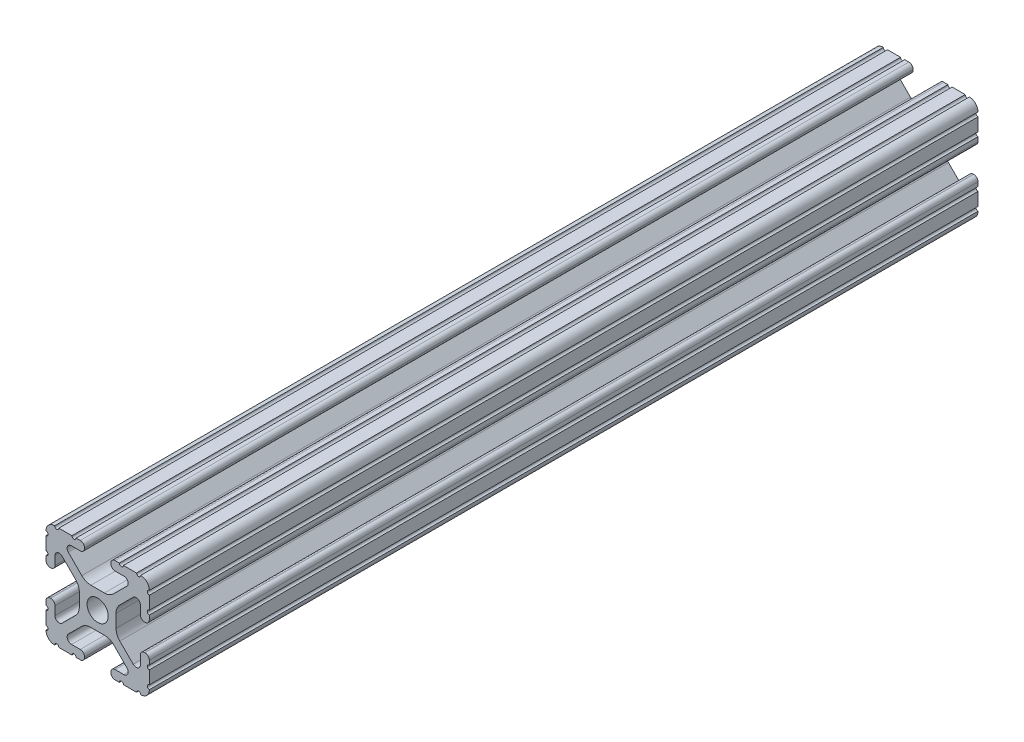
from build123d import *

# Parameters (mm, degrees)
EXTRUDE1_DEPTH      = 0.508
EXTRUDE1_DEPTH_BACK = 203.2
SKETCH1_R           = 2.6035


with BuildPart() as part:
    # Sketch1 → Extrude1 (new, two sides: drawn at the far end of the back side and taken through both)
    with BuildSketch(Plane.XY.offset(-EXTRUDE1_DEPTH_BACK)):
        with BuildLine():
            Line((-7.207036008, 8.724370562), (-3.898272566, 5.423169045))
            ThreePointArc((-3.898272566, 5.423169045), (-2.869120213, 4.736787962), (-1.655778399, 4.4958))
            Line((-1.655778399, 4.4958), (1.655778399, 4.4958))
            ThreePointArc((1.655778399, 4.4958), (2.869120213, 4.736787962), (3.898272566, 5.423169045))
            Line((3.898272566, 5.423169045), (7.207036008, 8.724370562))
            ThreePointArc((7.207036008, 8.724370562), (7.432222385, 9.85140422), (6.476788598, 10.4902))
            Line((6.476788598, 10.4902), (4.287512407, 10.4902))
            ThreePointArc((4.287512407, 10.4902), (3.54574862, 10.79744862), (3.2385, 11.539212407))
            Line((3.2385, 11.539212407), (3.2385, 11.650987593))
            ThreePointArc((3.2385, 11.650987593), (3.54574862, 12.39275138), (4.287512407, 12.7))
            Line((4.287512407, 12.7), (5.317126718, 12.7))
            ThreePointArc((5.317126718, 12.7), (5.825126718, 12.192), (6.333126718, 12.7))
            Line((6.333126718, 12.7), (9.550443118, 12.7))
            ThreePointArc((9.550443118, 12.7), (10.058366869, 12.192000006), (10.566443095, 12.699847501))
            ThreePointArc((10.566443095, 12.699847501), (12.082537762, 12.08250727), (12.699846982, 10.566399977))
            ThreePointArc((12.699846982, 10.566399977), (12.192000006, 10.058323491), (12.7, 9.5504))
            Line((12.7, 9.5504), (12.7, 6.3330836))
            ThreePointArc((12.7, 6.3330836), (12.192, 5.8250836), (12.7, 5.3170836))
            Line((12.7, 5.3170836), (12.7, 4.287469289))
            ThreePointArc((12.7, 4.287469289), (12.39275138, 3.545705502), (11.650987593, 3.238456882))
            Line((11.650987593, 3.238456882), (11.539212407, 3.238456882))
            ThreePointArc((11.539212407, 3.238456882), (10.79744862, 3.545705502), (10.4902, 4.287469289))
            Line((10.4902, 4.287469289), (10.4902, 6.402089023))
            ThreePointArc((10.4902, 6.402089023), (9.856505071, 7.351067942), (8.737131347, 7.129408934))
            Line((8.737131347, 7.129408934), (5.441005833, 3.840816462))
            ThreePointArc((5.441005833, 3.840816462), (4.750877967, 2.809883091), (4.5085, 1.593185507))
            Line((4.5085, 1.593185507), (4.5085, -1.593185507))
            ThreePointArc((4.5085, -1.593185507), (4.750877967, -2.809883091), (5.441005833, -3.840816462))
            Line((5.441005833, -3.840816462), (8.737131347, -7.129408934))
            ThreePointArc((8.737131347, -7.129408934), (9.856505071, -7.351067942), (10.4902, -6.402089023))
            Line((10.4902, -6.402089023), (10.4902, -4.287469289))
            ThreePointArc((10.4902, -4.287469289), (10.79744862, -3.545705502), (11.539212407, -3.238456882))
            Line((11.539212407, -3.238456882), (11.650987593, -3.238456882))
            ThreePointArc((11.650987593, -3.238456882), (12.39275138, -3.545705502), (12.7, -4.287469289))
            Line((12.7, -4.287469289), (12.7, -5.3170836))
            ThreePointArc((12.7, -5.3170836), (12.192, -5.8250836), (12.7, -6.3330836))
            Line((12.7, -6.3330836), (12.7, -9.5504))
            ThreePointArc((12.7, -9.5504), (12.192000006, -10.058323491), (12.699846982, -10.566399977))
            ThreePointArc((12.699846982, -10.566399977), (12.082537762, -12.08250727), (10.566443095, -12.699847501))
            ThreePointArc((10.566443095, -12.699847501), (10.058366869, -12.192000006), (9.550443118, -12.7))
            Line((9.550443118, -12.7), (6.333126718, -12.7))
            ThreePointArc((6.333126718, -12.7), (5.825126718, -12.192), (5.317126718, -12.7))
            Line((5.317126718, -12.7), (4.287512407, -12.7))
            ThreePointArc((4.287512407, -12.7), (3.54574862, -12.39275138), (3.2385, -11.650987593))
            Line((3.2385, -11.650987593), (3.2385, -11.539212407))
            ThreePointArc((3.2385, -11.539212407), (3.54574862, -10.79744862), (4.287512407, -10.4902))
            Line((4.287512407, -10.4902), (6.416408329, -10.4902))
            ThreePointArc((6.416408329, -10.4902), (7.41473083, -9.822813117), (7.179650497, -8.645192506))
            Line((7.179650497, -8.645192506), (3.952270251, -5.423690499))
            ThreePointArc((3.952270251, -5.423690499), (2.922936451, -4.736929036), (1.709253557, -4.4958))
            Line((1.709253557, -4.4958), (-1.709253557, -4.4958))
            ThreePointArc((-1.709253557, -4.4958), (-2.922936451, -4.736929036), (-3.952270251, -5.423690499))
            Line((-3.952270251, -5.423690499), (-7.179650497, -8.645192506))
            ThreePointArc((-7.179650497, -8.645192506), (-7.41473083, -9.822813117), (-6.416408329, -10.4902))
            Line((-6.416408329, -10.4902), (-4.287512407, -10.4902))
            ThreePointArc((-4.287512407, -10.4902), (-3.54574862, -10.79744862), (-3.2385, -11.539212407))
            Line((-3.2385, -11.539212407), (-3.2385, -11.650987593))
            ThreePointArc((-3.2385, -11.650987593), (-3.54574862, -12.39275138), (-4.287512407, -12.7))
            Line((-4.287512407, -12.7), (-5.317126718, -12.7))
            ThreePointArc((-5.317126718, -12.7), (-5.825126718, -12.192), (-6.333126718, -12.7))
            Line((-6.333126718, -12.7), (-9.550443118, -12.7))
            ThreePointArc((-9.550443118, -12.7), (-10.058366869, -12.192000006), (-10.566443095, -12.699847501))
            ThreePointArc((-10.566443095, -12.699847501), (-12.082537762, -12.08250727), (-12.699846982, -10.566399977))
            ThreePointArc((-12.699846982, -10.566399977), (-12.192000006, -10.058323491), (-12.7, -9.5504))
            Line((-12.7, -9.5504), (-12.7, -6.3330836))
            ThreePointArc((-12.7, -6.3330836), (-12.192, -5.8250836), (-12.7, -5.3170836))
            Line((-12.7, -5.3170836), (-12.7, -4.287469289))
            ThreePointArc((-12.7, -4.287469289), (-12.39275138, -3.545705502), (-11.650987593, -3.238456882))
            Line((-11.650987593, -3.238456882), (-11.539212407, -3.238456882))
            ThreePointArc((-11.539212407, -3.238456882), (-10.79744862, -3.545705502), (-10.4902, -4.287469289))
            Line((-10.4902, -4.287469289), (-10.4902, -6.402089023))
            ThreePointArc((-10.4902, -6.402089023), (-9.856505071, -7.351067942), (-8.737131347, -7.129408934))
            Line((-8.737131347, -7.129408934), (-5.441005833, -3.840816462))
            ThreePointArc((-5.441005833, -3.840816462), (-4.750877967, -2.809883091), (-4.5085, -1.593185507))
            Line((-4.5085, -1.593185507), (-4.5085, 1.593185507))
            ThreePointArc((-4.5085, 1.593185507), (-4.750877967, 2.809883091), (-5.441005833, 3.840816462))
            Line((-5.441005833, 3.840816462), (-8.737131347, 7.129408934))
            ThreePointArc((-8.737131347, 7.129408934), (-9.856505071, 7.351067942), (-10.4902, 6.402089023))
            Line((-10.4902, 6.402089023), (-10.4902, 4.287469289))
            ThreePointArc((-10.4902, 4.287469289), (-10.79744862, 3.545705502), (-11.539212407, 3.238456882))
            Line((-11.539212407, 3.238456882), (-11.650987593, 3.238456882))
            ThreePointArc((-11.650987593, 3.238456882), (-12.39275138, 3.545705502), (-12.7, 4.287469289))
            Line((-12.7, 4.287469289), (-12.7, 5.3170836))
            ThreePointArc((-12.7, 5.3170836), (-12.192, 5.8250836), (-12.7, 6.3330836))
            Line((-12.7, 6.3330836), (-12.7, 9.5504))
            ThreePointArc((-12.7, 9.5504), (-12.192000006, 10.058323491), (-12.699846982, 10.566399977))
            ThreePointArc((-12.699846982, 10.566399977), (-12.082537762, 12.08250727), (-10.566443095, 12.699847501))
            ThreePointArc((-10.566443095, 12.699847501), (-10.058366869, 12.192000006), (-9.550443118, 12.7))
            Line((-9.550443118, 12.7), (-6.333126718, 12.7))
            ThreePointArc((-6.333126718, 12.7), (-5.825126718, 12.192), (-5.317126718, 12.7))
            Line((-5.317126718, 12.7), (-4.287512407, 12.7))
            ThreePointArc((-4.287512407, 12.7), (-3.54574862, 12.39275138), (-3.2385, 11.650987593))
            Line((-3.2385, 11.650987593), (-3.2385, 11.539212407))
            ThreePointArc((-3.2385, 11.539212407), (-3.54574862, 10.79744862), (-4.287512407, 10.4902))
            Line((-4.287512407, 10.4902), (-6.476788598, 10.4902))
            ThreePointArc((-6.476788598, 10.4902), (-7.432222385, 9.85140422), (-7.207036008, 8.724370562))
        make_face()
        Circle(SKETCH1_R, mode=Mode.SUBTRACT)
    extrude(amount=EXTRUDE1_DEPTH + EXTRUDE1_DEPTH_BACK)


solid = part.part
